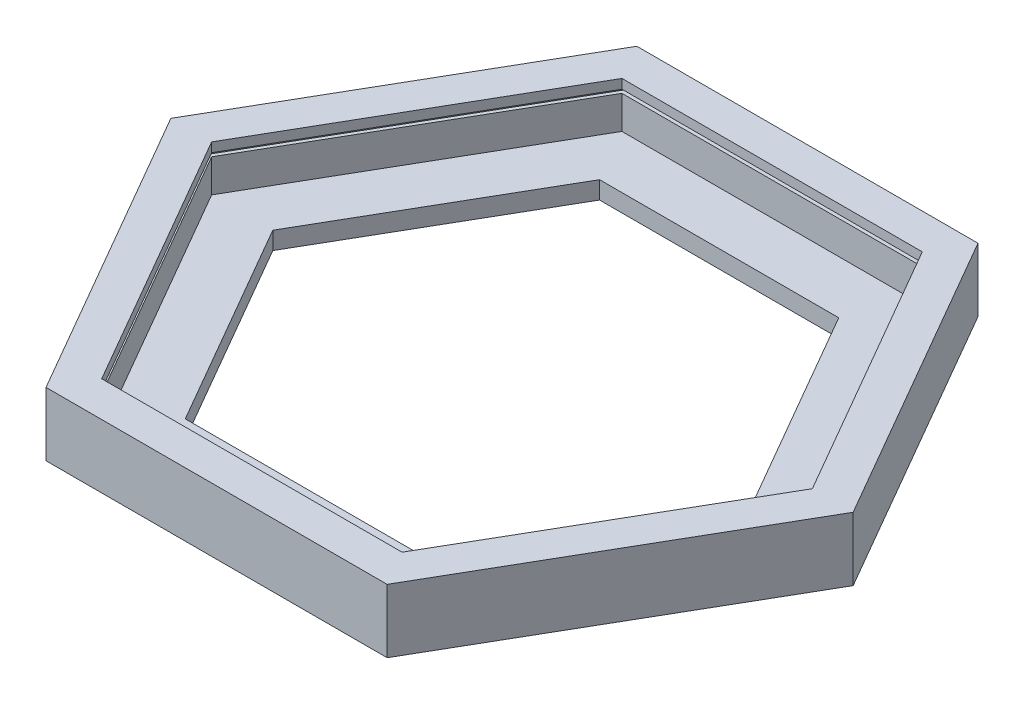
from build123d import *

# Parameters (mm, degrees)
BOSS_EXTRUDE1_DEPTH = 5
BOSS_EXTRUDE2_DEPTH = 18
CUT_EXTRUDE1_DEPTH  = 1


with BuildPart() as part:
    # Sketch1 → Boss-Extrude1 (new body)
    with BuildSketch(Plane(origin=(0, 0, 0), x_dir=(1, 0, 0), z_dir=(0, 1, 0))):
        Polygon((-96.599564284, 0), (-48.299782142, -83.657676664), (48.299782142, -83.657676664), (96.599564284, 0), (48.299782142, 83.657676664), (-48.299782142, 83.657676664), align=None)
        Polygon((-33.866025412, 58.657676664), (33.866025412, 58.657676664), (67.732050824, 0), (33.866025412, -58.657676664), (-33.866025412, -58.657676664), (-67.732050824, 0), align=None, mode=Mode.SUBTRACT)
    extrude(amount=BOSS_EXTRUDE1_DEPTH)

    # Sketch1<3> → Boss-Extrude2 (add)
    with BuildSketch(Plane(origin=(0, 0, 0), x_dir=(1, 0, 0), z_dir=(0, 1, 0))):
        Polygon((-96.599564284, 0), (-48.299782142, -83.657676664), (48.299782142, -83.657676664), (96.599564284, 0), (48.299782142, 83.657676664), (-48.299782142, 83.657676664), align=None)
        Polygon((42.52627945, -73.657676664), (-42.52627945, -73.657676664), (-85.0525589, 0), (-42.52627945, 73.657676664), (42.52627945, 73.657676664), (85.0525589, 0), align=None, mode=Mode.SUBTRACT)
    extrude(amount=BOSS_EXTRUDE2_DEPTH)

    # Sketch2 → Cut-Extrude1 (cut)
    with BuildSketch(Plane(origin=(0, 14.35, 0), x_dir=(1, 0, 0), z_dir=(0, 1, 0))):
        Polygon((86.207259438, 0), (43.103629719, 74.657676664), (-43.103629719, 74.657676664), (-86.207259438, 0), (-43.103629719, -74.657676664), (43.103629719, -74.657676664), align=None)
        Polygon((85.0525589, 0), (42.52627945, 73.657676664), (-42.52627945, 73.657676664), (-85.0525589, 0), (-42.52627945, -73.657676664), (42.52627945, -73.657676664), align=None, mode=Mode.SUBTRACT)
    extrude(amount=CUT_EXTRUDE1_DEPTH, mode=Mode.SUBTRACT)


solid = part.part
